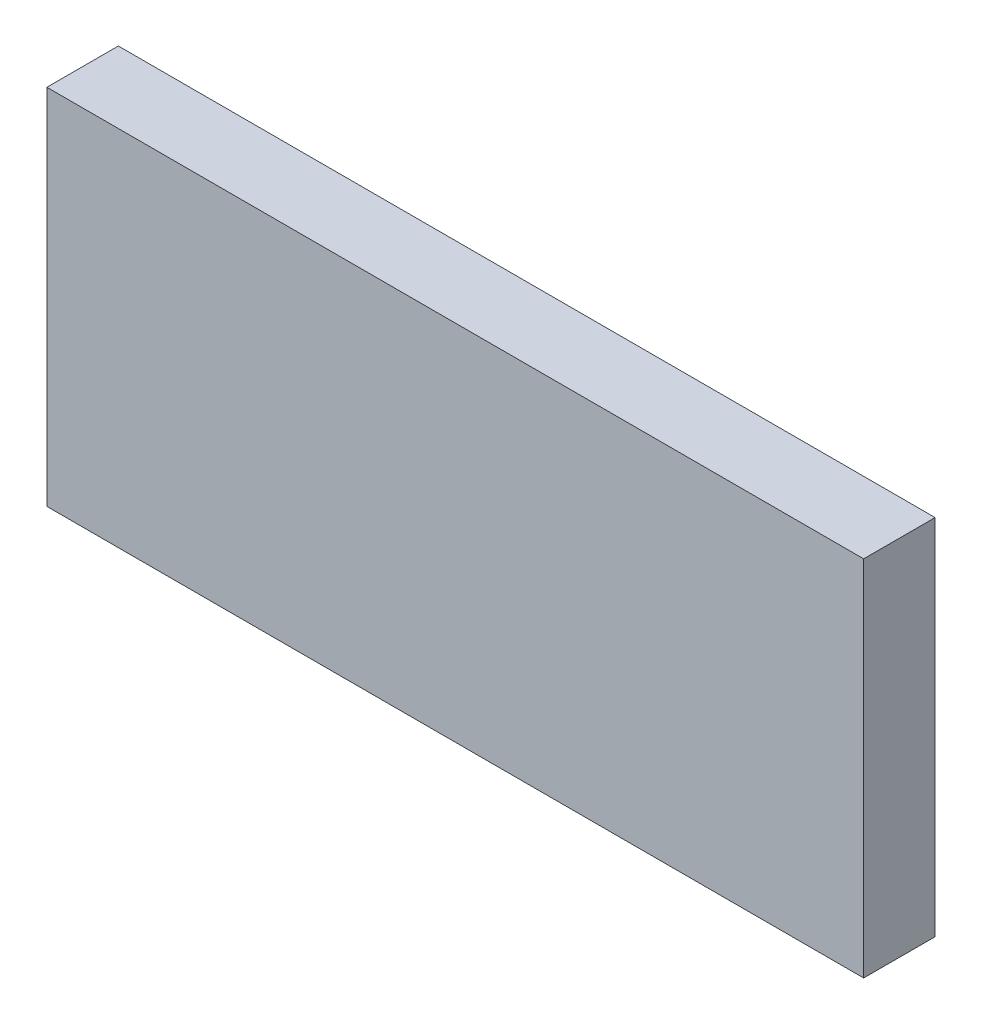
from build123d import *

# Parameters (mm, degrees)
SKIZZE1_W               = 11.43
SKIZZE1_H               = 5.08
COMPONENT_OUTLINE_DEPTH = 1


with BuildPart() as part:
    # Skizze1 → Component_Outline (new body)
    with BuildSketch(Plane.XY):
        Rectangle(SKIZZE1_W, SKIZZE1_H)
    extrude(amount=COMPONENT_OUTLINE_DEPTH)


solid = part.part
